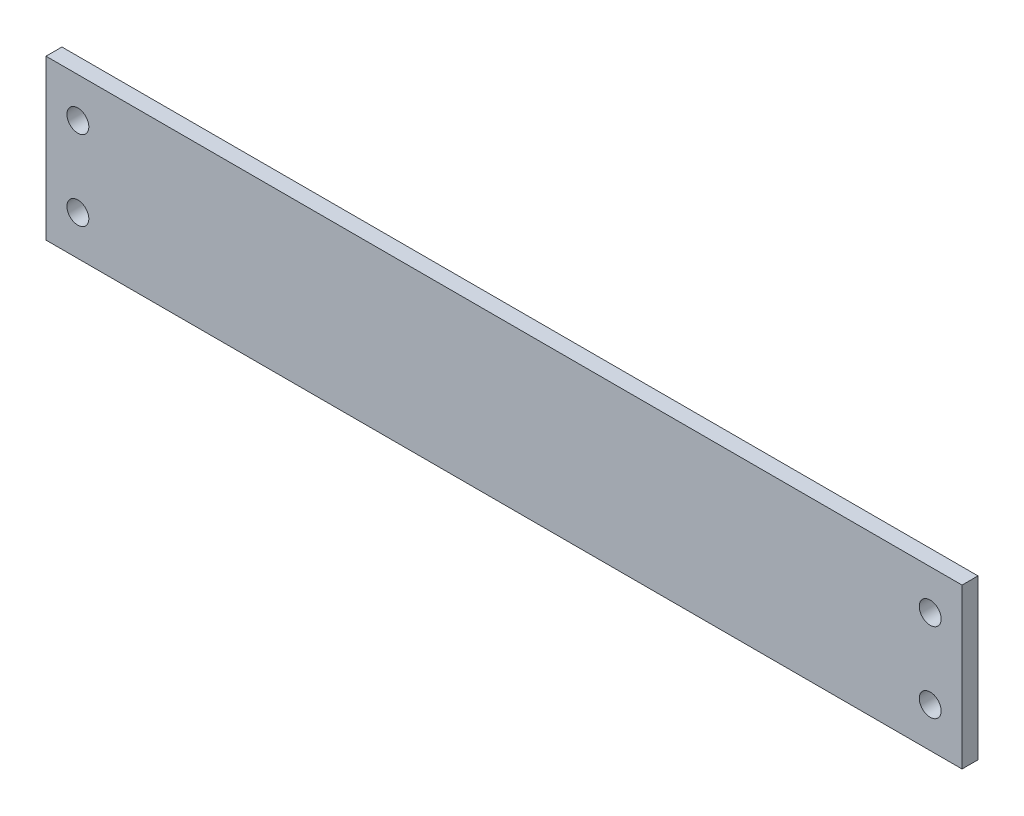
from build123d import *

# Parameters (mm, degrees)
EXTRUSION_BASE_SKETCH_W      = 230
EXTRUSION_BASE_SKETCH_H      = 40
EXTRUSION_BASE_EXTRUDE_DEPTH = 4
M5_MOUNTING_HOLES_D          = 5.5


with BuildPart() as part:
    # Extrusion Base Sketch → Extrusion Base Extrude (new body)
    with BuildSketch(Plane.XY):
        with Locations((115, 20)):
            Rectangle(EXTRUSION_BASE_SKETCH_W, EXTRUSION_BASE_SKETCH_H)
    extrude(amount=-EXTRUSION_BASE_EXTRUDE_DEPTH)

    # M5 Mounting Holes (through all)
    with Locations(Plane(origin=(0, 0, -4), x_dir=(-1, 0, 0), z_dir=(0, 0, -1))):
        with Locations((-222, 30), (-222, 10), (-8, 30), (-8, 10)):
            Hole(M5_MOUNTING_HOLES_D / 2)


solid = part.part
